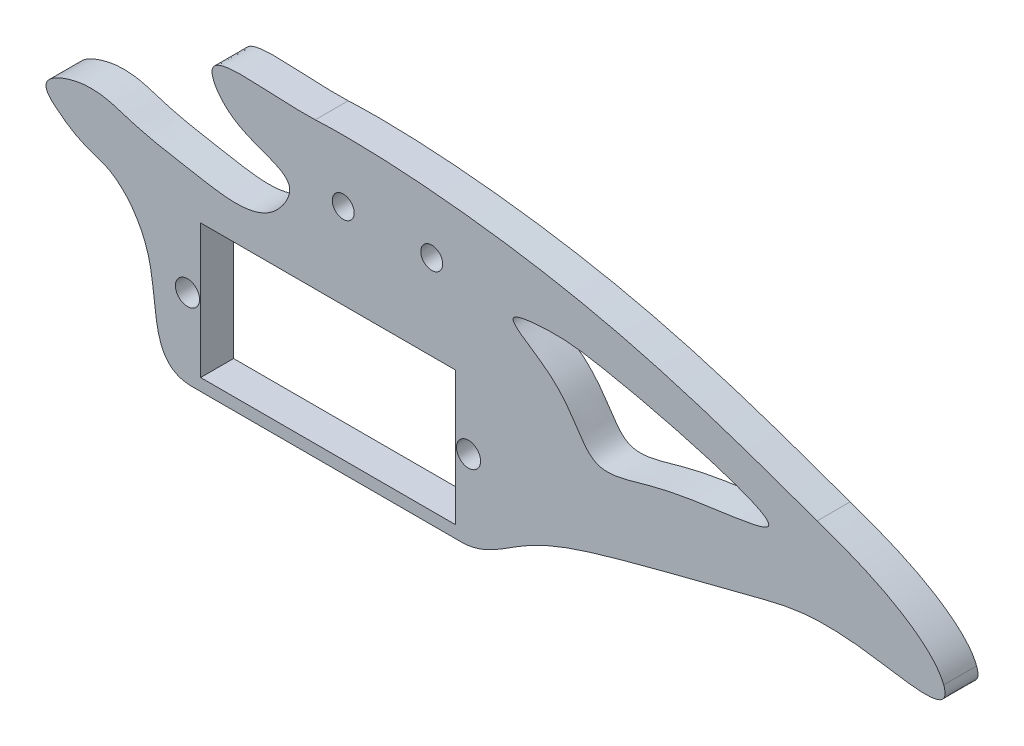
from build123d import *

# Parameters (mm, degrees)
IZIM1_R                     = 1.1
IZIM1_R_2                   = 1
IZIM1_W                     = 23.2
IZIM1_H                     = 12.2
Y_KSEKLIK_EKSTR_ZYON1_DEPTH = 3


with BuildPart() as part:
    # Çizim1 → Yükseklik-Ekstrüzyon1 (new body)
    with BuildSketch(Plane.XY):
        with BuildLine():
            Line((12.26515282, -7.345335078), (-12.235337427, -7.345335078))
            add(Edge.make_bspline(
                [(-12.235337427, -7.345335078), (-16.214500835, -7.345335078), (-14.661800211, 0.558315149), (-19.745392533, 6.868903319), (-22.437333365, 6.536545954), (-24.846259501, 8.614190435)],
                knots=[0, 0, 0, 0, 0.437166451, 0.729739406, 1, 1, 1, 1], degree=3))
            add(Edge.make_bspline(
                [(-1.055175912, 19.315596615), (-1.889483108, 19.276884473), (-5.401867483, 19.347704296), (-11.833854752, 19.851977444), (-8.313684396, 14.307373826), (-2.021960961, 14.170876921), (-5.638441386, 8.313723855), (-11.649967871, 9.580252194), (-17.355435094, 10.45740022), (-21.474762223, 12.197073251), (-26.214845545, 10.406096992), (-25.426619885, 9.114738182), (-24.846259501, 8.614190435)],
                knots=[0, 0, 0, 0, 0.070362386, 0.155384077, 0.208376842, 0.311744431, 0.352432055, 0.47685756, 0.569052151, 0.643479447, 0.705243668, 0.743354082, 0.743354082, 0.743354082, 0.743354082], degree=3))
            add(Edge.make_bspline(
                [(44.664588335, 10.532889161), (34.611664046, 14.180926474), (22.947418736, 18.085696578), (3.907170347, 19.545851194), (-1.055175912, 19.315596615)],
                knots=[0, 0, 0, 0, 0.663075295, 0.975069149, 0.975069149, 0.975069149, 0.975069149], degree=3))
            add(Edge.make_bspline(
                [(44.664588335, 10.532889161), (46.498131519, 9.867527147), (51.272350898, 8.225167426), (55.595387462, 4.912246062), (56.183113274, 3.358042913)],
                knots=[0, 0, 0, 0, 0.546915446, 1, 1, 1, 1], degree=3))
            add(Edge.make_bspline(
                [(12.26515282, -7.345335078), (14.290427878, -7.345335078), (18.204063041, -4.147705218), (26.733335824, -1.307892393), (38.543515668, 1.445116949), (45.643991375, 3.615387193), (57.099133869, 0.935685302), (56.183113274, 3.358042913)],
                knots=[0, 0, 0, 0, 0.131306773, 0.304515494, 0.607289141, 0.857344902, 1, 1, 1, 1], degree=3))
        make_face()
        with Locations((-12.69778463, -0.139850503)):
            Circle(IZIM1_R, mode=Mode.SUBTRACT)
        with Locations((12.90221537, -0.088605195)):
            Circle(IZIM1_R, mode=Mode.SUBTRACT)
        with Locations((1.492135288, 13.734948306)):
            Circle(IZIM1_R_2, mode=Mode.SUBTRACT)
        with Locations((9.552198999, 13.734948306)):
            Circle(IZIM1_R_2, mode=Mode.SUBTRACT)
        with BuildLine():
            add(Edge.make_bspline(
                [(24.565189553, 5.024768451), (25.869175835, 4.455495851), (31.396557168, 6.841542194), (46.277861788, 7.295203777), (31.268526651, 11.575571902), (24.774336438, 12.906515091), (21.077918382, 13.558691292), (15.225918786, 12.810026232), (22.171923305, 9.592412062), (23.153328657, 5.641135153), (24.565189553, 5.024768451)],
                knots=[0, 0, 0, 0, 0.114686735, 0.313852211, 0.537605762, 0.626373915, 0.737466003, 0.787216229, 0.875825598, 1, 1, 1, 1], degree=3))
        make_face(mode=Mode.SUBTRACT)
        with Locations((0.10221537, -0.139850503)):
            Rectangle(IZIM1_W, IZIM1_H, mode=Mode.SUBTRACT)
    extrude(amount=Y_KSEKLIK_EKSTR_ZYON1_DEPTH)


solid = part.part
